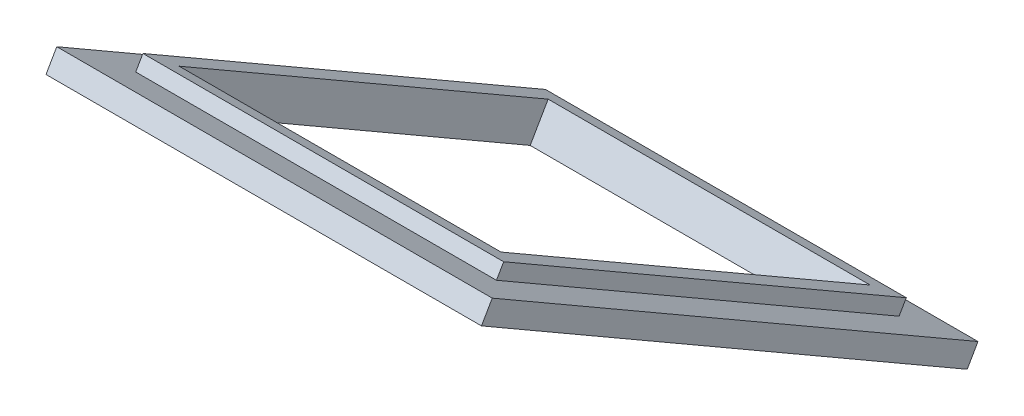
from build123d import *

# Parameters (mm, degrees)
SKETCH1_W           = 60.6
SKETCH1_H           = 78.05786816
SKETCH1_W_2         = 44.8
SKETCH1_H_2         = 59.3
BOSS_EXTRUDE1_DEPTH = 3
SKETCH2_W           = 50.200000001
SKETCH2_H           = 64.7
SKETCH2_W_2         = 44.8
SKETCH2_H_2         = 59.299999999
BOSS_EXTRUDE2_DEPTH = 2


with BuildPart() as part:
    # Sketch1 → Boss-Extrude1 (new body)
    with BuildSketch(Plane(origin=(-8e-09, -784.034696128, -1198.711383076), x_dir=(1, 0, 0), z_dir=(0, 0.8660254037844385, -0.5000000000000002))):
        with Locations((-7.807791054, -1437.18747743)):
            Rectangle(SKETCH1_W, SKETCH1_H)
        with Locations((-7.807791055, -1437.183756537)):
            Rectangle(SKETCH1_W_2, SKETCH1_H_2, mode=Mode.SUBTRACT)
    extrude(amount=-BOSS_EXTRUDE1_DEPTH)

    # Sketch2 → Boss-Extrude2 (add)
    with BuildSketch(Plane(origin=(0, -68.968767322, 39.819136379), x_dir=(1, 0, 0), z_dir=(0, 0.8660254037844385, -0.5000000000000002))):
        with Locations((-7.807791061, -7.051898924)):
            Rectangle(SKETCH2_W, SKETCH2_H)
        with Locations((-7.807791063, -7.051898923)):
            Rectangle(SKETCH2_W_2, SKETCH2_H_2, mode=Mode.SUBTRACT)
    extrude(amount=BOSS_EXTRUDE2_DEPTH)


solid = part.part
